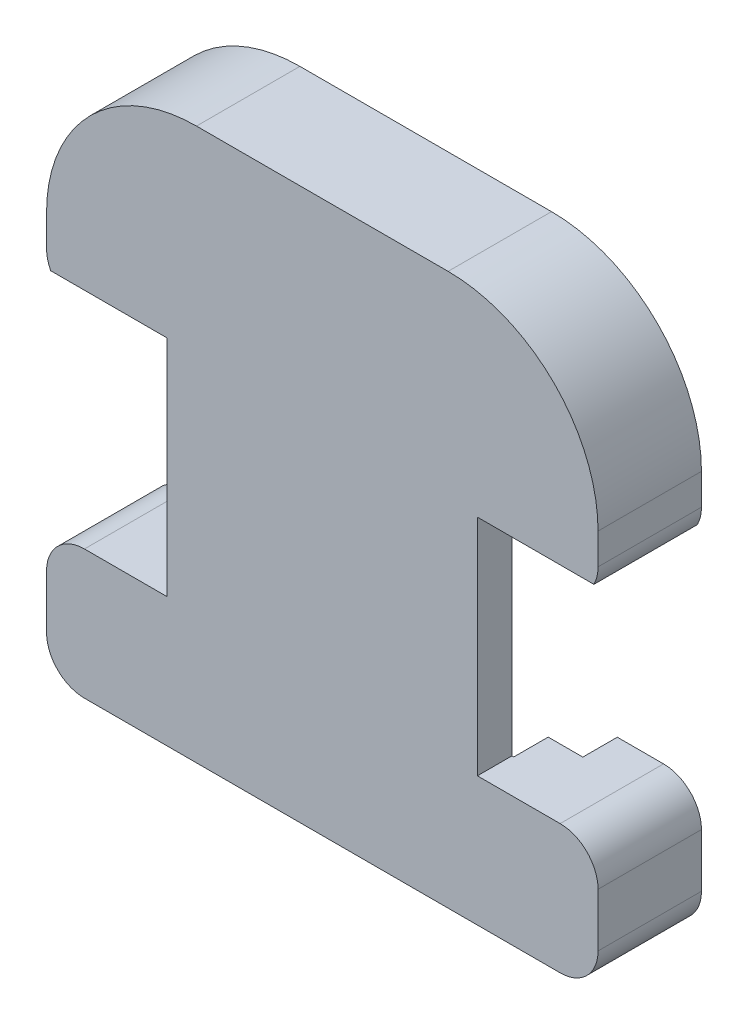
from build123d import *

# Parameters (mm, degrees)
BOSS_EXTRUDE1_DEPTH      = 10.16
CUT_EXTRUDE1_DEPTH       = 5.08
BOSS_EXTRUDE2_DEPTH      = 5.08
BOSS_EXTRUDE2_DEPTH_BACK = 10.16
CUT_EXTRUDE2_REACH       = 91.91
SKETCH8_W                = 23.622
SKETCH8_H                = 33.02


with BuildPart() as part:
    # Sketch1 → Boss-Extrude1 (new body)
    with BuildSketch(Plane.XY.offset(2.54)):
        with BuildLine():
            Line((-35.052, 0), (35.052, 0))
            ThreePointArc((35.052, 0), (37.207261469, 0.892738531), (38.1, 3.048))
            Line((38.1, 3.048), (38.1, 10.922))
            ThreePointArc((38.1, 10.922), (37.207261469, 13.077261469), (35.052, 13.97))
            Line((35.052, 13.97), (31.242, 13.97))
            ThreePointArc((31.242, 13.97), (29.086738531, 14.862738531), (28.194, 17.018))
            Line((28.194, 17.018), (28.194, 45.974))
            ThreePointArc((28.194, 45.974), (29.086738531, 48.129261469), (31.242, 49.022))
            Line((31.242, 49.022), (35.052, 49.022))
            ThreePointArc((35.052, 49.022), (37.207261469, 49.914738531), (38.1, 52.07))
            Line((38.1, 52.07), (38.1, 56.642))
            ThreePointArc((38.1, 56.642), (32.371594426, 70.471594426), (18.542, 76.2))
            Line((18.542, 76.2), (-18.542, 76.2))
            ThreePointArc((-18.542, 76.2), (-32.371594426, 70.471594426), (-38.1, 56.642))
            Line((-38.1, 56.642), (-38.1, 52.07))
            ThreePointArc((-38.1, 52.07), (-37.207261469, 49.914738531), (-35.052, 49.022))
            Line((-35.052, 49.022), (-31.242, 49.022))
            ThreePointArc((-31.242, 49.022), (-29.086738531, 48.129261469), (-28.194, 45.974))
            Line((-28.194, 45.974), (-28.194, 17.018))
            ThreePointArc((-28.194, 17.018), (-29.086738531, 14.862738531), (-31.242, 13.97))
            Line((-31.242, 13.97), (-35.052, 13.97))
            ThreePointArc((-35.052, 13.97), (-37.207261469, 13.077261469), (-38.1, 10.922))
            Line((-38.1, 10.922), (-38.1, 3.048))
            ThreePointArc((-38.1, 3.048), (-37.207261469, 0.892738531), (-35.052, 0))
        make_face()
    extrude(amount=-BOSS_EXTRUDE1_DEPTH)

    # Sketch2 → Cut-Extrude1 (cut)
    with BuildSketch(Plane(origin=(0, 0, -7.62), x_dir=(-1, 0, 0), z_dir=(0, 0, -1))):
        with BuildLine():
            Line((33.02, 54.102), (33.02, 56.642))
            ThreePointArc((33.02, 56.642), (28.779491978, 66.879491978), (18.542, 71.12))
            Line((18.542, 71.12), (-18.542, 71.12))
            ThreePointArc((-18.542, 71.12), (-28.779491978, 66.879491978), (-33.02, 56.642))
            Line((-33.02, 56.642), (-33.02, 54.102))
            Line((-33.02, 54.102), (-31.242, 54.102))
            ThreePointArc((-31.242, 54.102), (-25.494636083, 51.721363917), (-23.114, 45.974))
            Line((-23.114, 45.974), (-23.114, 17.018))
            ThreePointArc((-23.114, 17.018), (-25.494636083, 11.270636083), (-31.242, 8.89))
            Line((-31.242, 8.89), (-33.02, 8.89))
            Line((-33.02, 8.89), (-33.02, 5.08))
            Line((-33.02, 5.08), (33.02, 5.08))
            Line((33.02, 5.08), (33.02, 8.89))
            Line((33.02, 8.89), (31.242, 8.89))
            ThreePointArc((31.242, 8.89), (25.494636083, 11.270636083), (23.114, 17.018))
            Line((23.114, 17.018), (23.114, 45.974))
            ThreePointArc((23.114, 45.974), (25.494636083, 51.721363917), (31.242, 54.102))
            Line((31.242, 54.102), (33.02, 54.102))
        make_face()
    extrude(amount=-CUT_EXTRUDE1_DEPTH, mode=Mode.SUBTRACT)

    # Sketch7 → Boss-Extrude2 (add, two sides: drawn at the far end of the back side and taken through both)
    with BuildSketch(Plane(origin=(0, 0, -7.62), x_dir=(-1, 0, 0), z_dir=(0, 0, -1)).offset(-BOSS_EXTRUDE2_DEPTH_BACK)):
        with BuildLine():
            Line((18.542, 78.74), (-18.542, 78.74))
            ThreePointArc((-18.542, 78.74), (-34.167645651, 72.267645651), (-40.64, 56.642))
            Line((-40.64, 56.642), (-40.64, 52.07))
            ThreePointArc((-40.64, 52.07), (-39.003312693, 48.118687307), (-35.052, 46.482))
            Line((-35.052, 46.482), (-31.242, 46.482))
            ThreePointArc((-31.242, 46.482), (-30.882789755, 46.333210245), (-30.734, 45.974))
            Line((-30.734, 45.974), (-30.734, 17.018))
            ThreePointArc((-30.734, 17.018), (-30.882789755, 16.658789755), (-31.242, 16.51))
            Line((-31.242, 16.51), (-35.052, 16.51))
            ThreePointArc((-35.052, 16.51), (-39.003312693, 14.873312693), (-40.64, 10.922))
            Line((-40.64, 10.922), (-40.64, 3.048))
            ThreePointArc((-40.64, 3.048), (-39.003312693, -0.903312693), (-35.052, -2.54))
            Line((-35.052, -2.54), (35.052, -2.54))
            ThreePointArc((35.052, -2.54), (39.003312693, -0.903312693), (40.64, 3.048))
            Line((40.64, 3.048), (40.64, 10.922))
            ThreePointArc((40.64, 10.922), (39.003312693, 14.873312693), (35.052, 16.51))
            Line((35.052, 16.51), (31.242, 16.51))
            ThreePointArc((31.242, 16.51), (30.882789755, 16.658789755), (30.734, 17.018))
            Line((30.734, 17.018), (30.734, 45.974))
            ThreePointArc((30.734, 45.974), (30.882789755, 46.333210245), (31.242, 46.482))
            Line((31.242, 46.482), (35.052, 46.482))
            ThreePointArc((35.052, 46.482), (39.003312693, 48.118687307), (40.64, 52.07))
            Line((40.64, 52.07), (40.64, 56.642))
            ThreePointArc((40.64, 56.642), (34.167645651, 72.267645651), (18.542, 78.74))
        make_face()
        with BuildLine():
            ThreePointArc((-38.1, 52.07), (-37.207261469, 49.914738531), (-35.052, 49.022))
            Line((-35.052, 49.022), (-31.242, 49.022))
            ThreePointArc((-31.242, 49.022), (-29.086738531, 48.129261469), (-28.194, 45.974))
            Line((-28.194, 45.974), (-28.194, 17.018))
            ThreePointArc((-28.194, 17.018), (-29.086738531, 14.862738531), (-31.242, 13.97))
            Line((-31.242, 13.97), (-35.052, 13.97))
            ThreePointArc((-35.052, 13.97), (-37.207261469, 13.077261469), (-38.1, 10.922))
            Line((-38.1, 10.922), (-38.1, 3.048))
            ThreePointArc((-38.1, 3.048), (-37.207261469, 0.892738531), (-35.052, 0))
            Line((-35.052, 0), (35.052, 0))
            ThreePointArc((35.052, 0), (37.207261469, 0.892738531), (38.1, 3.048))
            Line((38.1, 3.048), (38.1, 10.922))
            ThreePointArc((38.1, 10.922), (37.207261469, 13.077261469), (35.052, 13.97))
            Line((35.052, 13.97), (31.242, 13.97))
            ThreePointArc((31.242, 13.97), (29.086738531, 14.862738531), (28.194, 17.018))
            Line((28.194, 17.018), (28.194, 45.974))
            ThreePointArc((28.194, 45.974), (29.086738531, 48.129261469), (31.242, 49.022))
            Line((31.242, 49.022), (35.052, 49.022))
            ThreePointArc((35.052, 49.022), (37.207261469, 49.914738531), (38.1, 52.07))
            Line((38.1, 52.07), (38.1, 56.642))
            ThreePointArc((38.1, 56.642), (32.371594426, 70.471594426), (18.542, 76.2))
            Line((18.542, 76.2), (-18.542, 76.2))
            ThreePointArc((-18.542, 76.2), (-32.371594426, 70.471594426), (-38.1, 56.642))
            Line((-38.1, 56.642), (-38.1, 52.07))
        make_face(mode=Mode.SUBTRACT)
    extrude(amount=BOSS_EXTRUDE2_DEPTH + BOSS_EXTRUDE2_DEPTH_BACK)

    # Cut-Extrude2: up to this face of the body (flat: up to its plane)
    cut_extrude2_end = Plane(part.part.faces().sort_by_distance((0, 37.604047464, 2.54))[0])
    # Sketch8 → Cut-Extrude2 (cut, up to the picked face)
    with BuildSketch(Plane(origin=(0, 0, -12.7), x_dir=(-1, 0, 0), z_dir=(0, 0, -1)), mode=Mode.PRIVATE) as cut_extrude2_sk1:
        with Locations((-34.671, 33.02)):
            Rectangle(SKETCH8_W, SKETCH8_H)
    cut_extrude2_tool1 = split(extrude(cut_extrude2_sk1.sketch, amount=-CUT_EXTRUDE2_REACH, mode=Mode.PRIVATE), bisect_by=cut_extrude2_end, keep=Keep.BOTH, mode=Mode.PRIVATE)
    # Sketch8 → Cut-Extrude2 (cut, up to the picked face)
    with BuildSketch(Plane(origin=(0, 0, -12.7), x_dir=(-1, 0, 0), z_dir=(0, 0, -1)), mode=Mode.PRIVATE) as cut_extrude2_sk2:
        with Locations((34.671, 33.02)):
            Rectangle(SKETCH8_W, SKETCH8_H)
    cut_extrude2_tool2 = split(extrude(cut_extrude2_sk2.sketch, amount=-CUT_EXTRUDE2_REACH, mode=Mode.PRIVATE), bisect_by=cut_extrude2_end, keep=Keep.BOTH, mode=Mode.PRIVATE)
    add(cut_extrude2_tool1.solids().sort_by(Axis((34.671, 33.02, -12.7), (0, 0, 1)))[0], mode=Mode.SUBTRACT)
    add(cut_extrude2_tool2.solids().sort_by(Axis((-34.671, 33.02, -12.7), (0, 0, 1)))[0], mode=Mode.SUBTRACT)


solid = part.part
